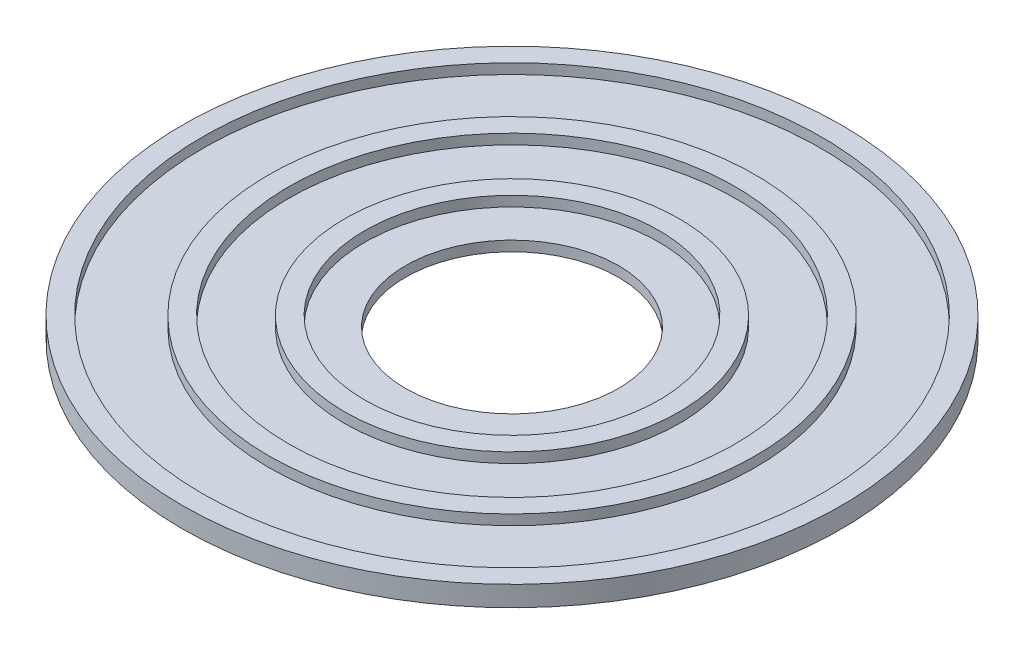
from build123d import *

# Parameters (mm, degrees)
SZKIC1_R                    = 32.5
SZKIC1_R_2                  = 10.5
DODANIE_WYCI_GNI_CIE1_DEPTH = 1
SZKIC2_R                    = 32.5
SZKIC2_R_2                  = 30.5
SZKIC2_R_3                  = 24
SZKIC2_R_4                  = 22
SZKIC2_R_5                  = 16.5
SZKIC2_R_6                  = 14.5
DODANIE_WYCI_GNI_CIE2_DEPTH = 1


with BuildPart() as part:
    # Szkic1 → Dodanie-wyciągnięcie1 (new body)
    with BuildSketch(Plane(origin=(0, 0, 0), x_dir=(1, 0, 0), z_dir=(0, 1, 0))):
        with Locations(Location((0, 0, 0), (0, 0, 270))):
            Circle(SZKIC1_R)
        with Locations(Location((0, 0, 0), (0, 0, 270))):
            Circle(SZKIC1_R_2, mode=Mode.SUBTRACT)
    extrude(amount=DODANIE_WYCI_GNI_CIE1_DEPTH)

    # Szkic2 → Dodanie-wyciągnięcie2 (add)
    # profile 1 of 3: a face of its own
    with BuildSketch(Plane(origin=(0, 1, 0), x_dir=(1, 0, 0), z_dir=(0, 1, 0))):
        with Locations(Location((0, 0, 0), (0, 0, 270))):
            Circle(SZKIC2_R)
        with Locations(Location((0, 0, 0), (0, 0, 270))):
            Circle(SZKIC2_R_2, mode=Mode.SUBTRACT)
    # profile 2 of 3: a face of its own
    with BuildSketch(Plane(origin=(0, 1, 0), x_dir=(1, 0, 0), z_dir=(0, 1, 0))):
        with Locations(Location((0, 0, 0), (0, 0, 270))):
            Circle(SZKIC2_R_3)
        with Locations(Location((0, 0, 0), (0, 0, 270))):
            Circle(SZKIC2_R_4, mode=Mode.SUBTRACT)
    # profile 3 of 3: a face of its own
    with BuildSketch(Plane(origin=(0, 1, 0), x_dir=(1, 0, 0), z_dir=(0, 1, 0))):
        with Locations(Location((0, 0, 0), (0, 0, 270))):
            Circle(SZKIC2_R_5)
        with Locations(Location((0, 0, 0), (0, 0, 270))):
            Circle(SZKIC2_R_6, mode=Mode.SUBTRACT)
    extrude(amount=DODANIE_WYCI_GNI_CIE2_DEPTH)


solid = part.part
